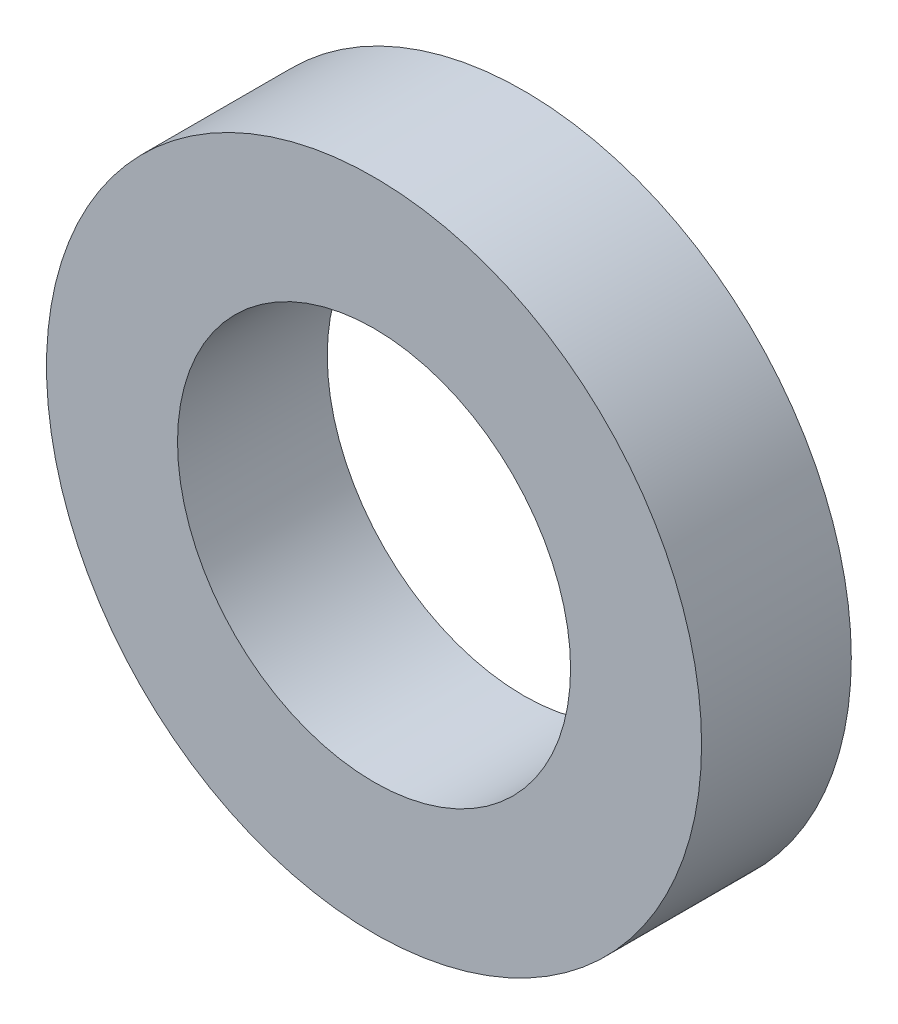
from build123d import *

# Parameters (mm, degrees)
ESQUISSE1_R        = 1.75
ESQUISSE1_R_2      = 1.05
BOSS_EXTRU_1_DEPTH = 0.4


with BuildPart() as part:
    # Esquisse1 → Boss.-Extru.1 (new, symmetric)
    with BuildSketch(Plane.XY):
        Circle(ESQUISSE1_R)
        Circle(ESQUISSE1_R_2, mode=Mode.SUBTRACT)
    extrude(amount=BOSS_EXTRU_1_DEPTH, both=True)


solid = part.part
